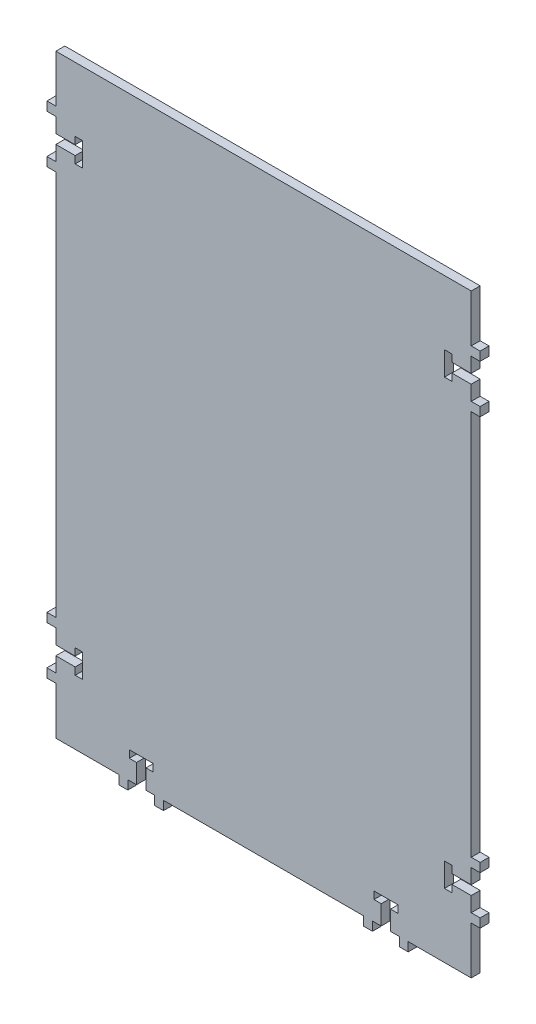
from build123d import *

# Parameters (mm, degrees)
BOSS_EXTRUDE1_DEPTH = 3


with BuildPart() as part:
    # Sketch1 → Boss-Extrude1 (new body)
    with BuildSketch(Plane.XY):
        Polygon((0, 27.15), (0, 32.15), (-3, 32.15), (-3, 35.15), (0, 35.15), (0, 164.85), (-3, 164.85), (-3, 167.85), (0, 167.85), (0, 172.85), (6.5, 172.85), (6.5, 170.425), (9, 170.425), (9, 178.425), (6.5, 178.425), (6.5, 176), (0, 176), (0, 181), (-3, 181), (-3, 184), (0, 184), (0, 200), (139.61, 200), (139.61, 184), (142.61, 184), (142.61, 181), (139.61, 181), (139.61, 176), (133.11, 176), (133.11, 178.425), (130.61, 178.425), (130.61, 170.425), (133.11, 170.425), (133.11, 172.85), (139.61, 172.85), (139.61, 167.85), (142.61, 167.85), (142.61, 164.85), (139.61, 164.85), (139.61, 35.15), (142.61, 35.15), (142.61, 32.15), (139.61, 32.15), (139.61, 27.15), (133.11, 27.15), (133.11, 29.575), (130.61, 29.575), (130.61, 21.575), (133.11, 21.575), (133.11, 24), (139.61, 24), (139.61, 19), (142.61, 19), (142.61, 16), (139.61, 16), (139.61, 0), (118.425, 0), (118.425, -3), (115.425, -3), (115.425, 0), (112.5, 0), (112.5, 6.5), (114.925, 6.5), (114.925, 9), (106.925, 9), (106.925, 6.5), (109.35, 6.5), (109.35, 0), (106.425, 0), (106.425, -3), (103.425, -3), (103.425, 0), (36.185, 0), (36.185, -3), (33.185, -3), (33.185, 0), (30.26, 0), (30.26, 6.5), (32.685, 6.5), (32.685, 9), (24.685, 9), (24.685, 6.5), (27.11, 6.5), (27.11, 0), (24.185, 0), (24.185, -3), (21.185, -3), (21.185, 0), (0, 0), (0, 16), (-3, 16), (-3, 19), (0, 19), (0, 24), (6.5, 24), (6.5, 21.575), (9, 21.575), (9, 29.575), (6.5, 29.575), (6.5, 27.15), align=None)
    extrude(amount=-BOSS_EXTRUDE1_DEPTH)


solid = part.part
